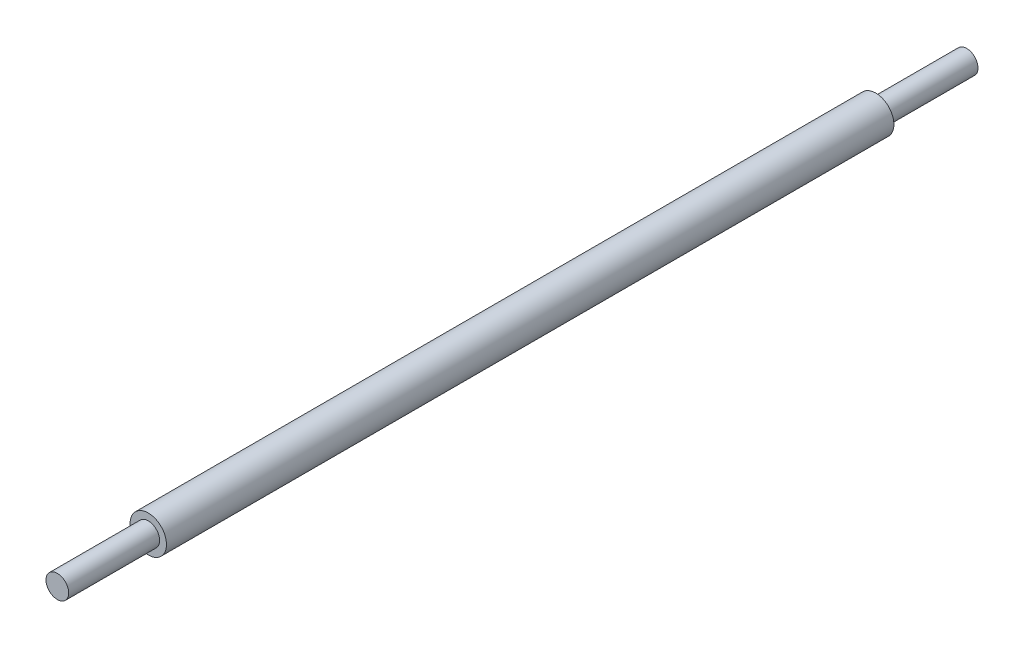
from build123d import *

# Parameters (mm, degrees)
SKETCH1_R           = 5.08
BOSS_EXTRUDE1_DEPTH = 101.6
SKETCH2_R           = 3.175
BOSS_EXTRUDE2_DEPTH = 25.4
SCALE1_SCALE        = 0.66


with BuildPart() as part:
    # Sketch1 → Boss-Extrude1 (new, symmetric)
    with BuildSketch(Plane.XY):
        Circle(SKETCH1_R)
    extrude(amount=BOSS_EXTRUDE1_DEPTH, both=True)

    # Sketch2 → Boss-Extrude2 (add)
    with BuildSketch(Plane.XY.offset(101.6)):
        Circle(SKETCH2_R)
    boss_extrude2 = extrude(amount=BOSS_EXTRUDE2_DEPTH)

    # Mirror1: Boss-Extrude2 across plane
    add(boss_extrude2.mirror(Plane.XY))


with BuildPart() as part_1:
    # Scale1: scaled about (0, 0, 0)
    add(part.part.scale(SCALE1_SCALE))


solid = part_1.part
